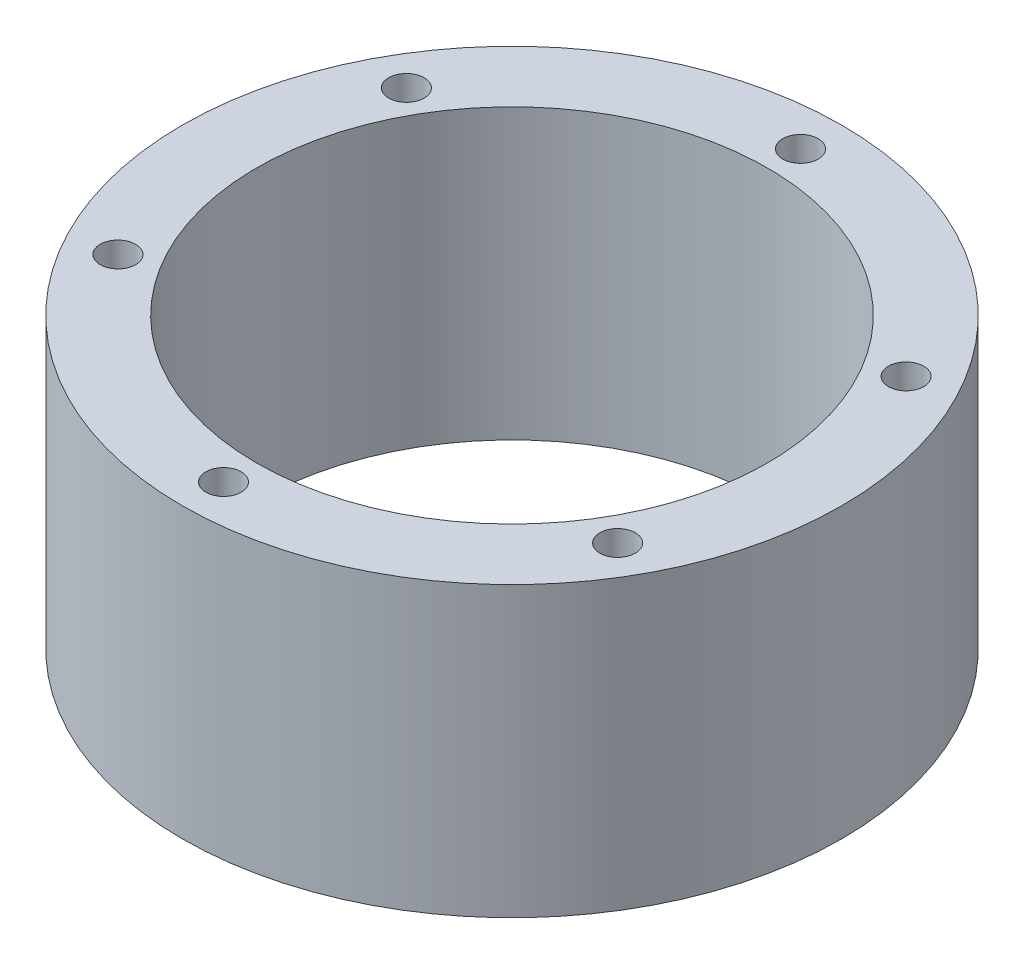
from build123d import *

# Parameters (mm, degrees)
SKETCH_1_R      = 40
SKETCH_1_R_2    = 31
SKETCH_1_R_3    = 2.15
EXTRUDE_3_DEPTH = 15
SKETCH_2_R      = 40
SKETCH_2_R_2    = 31
SKETCH_2_R_3    = 2.15
EXTRUDE_5_DEPTH = 20


with BuildPart() as part:
    # 草图1 → 凸台-拉伸3 (new body)
    with BuildSketch(Plane(origin=(0, 0, 0), x_dir=(1, 0, 0), z_dir=(0, 1, 0))):
        with Locations(Location((0, 0, 0), (0, 0, 270))):
            Circle(SKETCH_1_R)
        with Locations(Location((0, 0, 0), (0, 0, 270))):
            Circle(SKETCH_1_R_2, mode=Mode.SUBTRACT)
        with Locations(Location((0, 35, 0), (0, 0, 270))):
            Circle(SKETCH_1_R_3, mode=Mode.SUBTRACT)
        with Locations(Location((30.310889132, 17.5, 0), (0, 0, 270))):
            Circle(SKETCH_1_R_3, mode=Mode.SUBTRACT)
        with Locations(Location((30.310889132, -17.5, 0), (0, 0, 270))):
            Circle(SKETCH_1_R_3, mode=Mode.SUBTRACT)
        with Locations(Location((0, -35, 0), (0, 0, 270))):
            Circle(SKETCH_1_R_3, mode=Mode.SUBTRACT)
        with Locations(Location((-30.310889132, -17.5, 0), (0, 0, 270))):
            Circle(SKETCH_1_R_3, mode=Mode.SUBTRACT)
        with Locations(Location((-30.310889132, 17.5, 0), (0, 0, 270))):
            Circle(SKETCH_1_R_3, mode=Mode.SUBTRACT)
    extrude(amount=EXTRUDE_3_DEPTH)

    # 草图2 → 凸台-拉伸5 (add)
    with BuildSketch(Plane(origin=(0, 15, 0), x_dir=(1, 0, 0), z_dir=(0, 1, 0))):
        with Locations(Location((0, 0, 0), (0, 0, 270))):
            Circle(SKETCH_2_R)
        with Locations(Location((0, 0, 0), (0, 0, 270))):
            Circle(SKETCH_2_R_2, mode=Mode.SUBTRACT)
        with Locations(Location((0, 35, 0), (0, 0, 270))):
            Circle(SKETCH_2_R_3, mode=Mode.SUBTRACT)
        with Locations(Location((30.310889132, 17.5, 0), (0, 0, 270))):
            Circle(SKETCH_2_R_3, mode=Mode.SUBTRACT)
        with Locations(Location((30.310889132, -17.5, 0), (0, 0, 270))):
            Circle(SKETCH_2_R_3, mode=Mode.SUBTRACT)
        with Locations(Location((0, -35, 0), (0, 0, 270))):
            Circle(SKETCH_2_R_3, mode=Mode.SUBTRACT)
        with Locations(Location((-30.310889132, -17.5, 0), (0, 0, 270))):
            Circle(SKETCH_2_R_3, mode=Mode.SUBTRACT)
        with Locations(Location((-30.310889132, 17.5, 0), (0, 0, 270))):
            Circle(SKETCH_2_R_3, mode=Mode.SUBTRACT)
    extrude(amount=EXTRUDE_5_DEPTH)


solid = part.part
